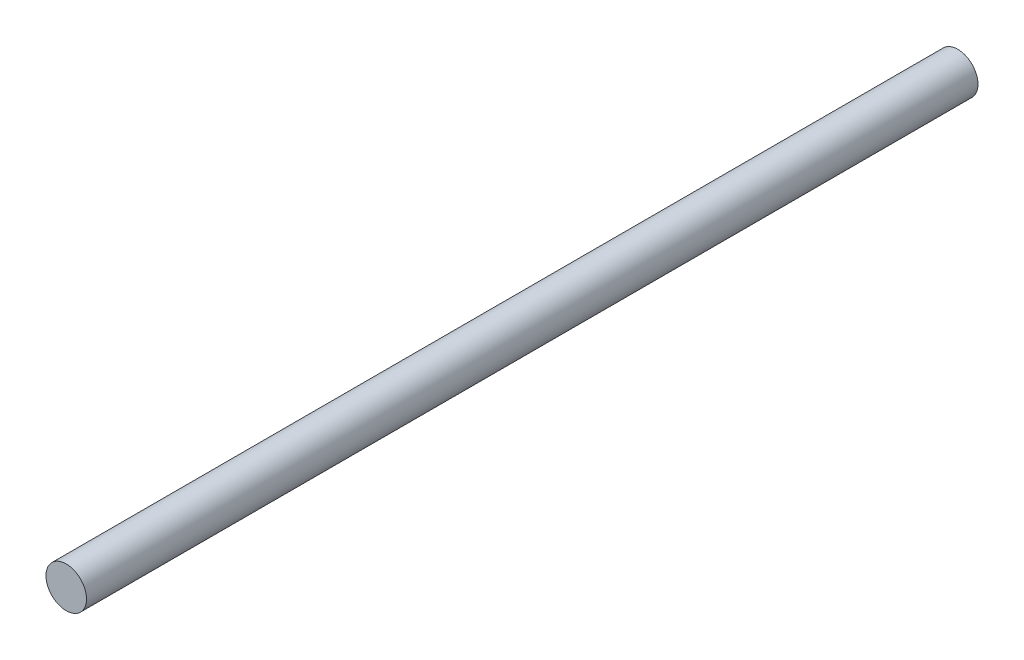
from build123d import *

# Parameters (mm, degrees)
SKETCH1_R           = 3.175
BOSS_EXTRUDE1_DEPTH = 139.7


with BuildPart() as part:
    # Sketch1 → Boss-Extrude1 (new body)
    with BuildSketch(Plane.XY):
        Circle(SKETCH1_R)
    extrude(amount=BOSS_EXTRUDE1_DEPTH)


solid = part.part
